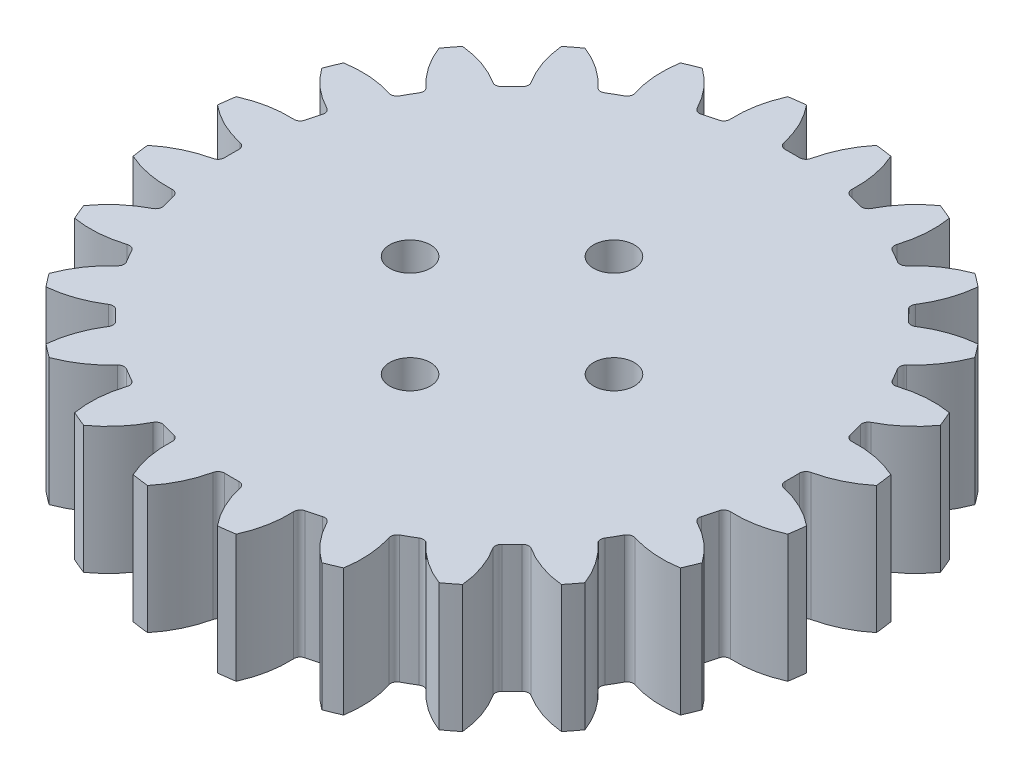
from build123d import *

# Parameters (mm, degrees)
SKETCH_1_R               = 26
EXTRUDE_1_DEPTH          = 10
CUT_EXTRUDE_1_DEPTH      = 39.105117767
PATTERN_CIRCULAR_1_COUNT = 24
SKETCH_3_R               = 1.6
CUT_EXTRUDE_2_DEPTH      = 38.907320131


with BuildPart() as part:
    # 草图1 → 凸台-拉伸1 (new body)
    with BuildSketch(Plane(origin=(0, 0, 0), x_dir=(1, 0, 0), z_dir=(0, 1, 0))):
        with Locations(Location((0, 0, 0), (0, 0, 270))):
            Circle(SKETCH_1_R)
    extrude(amount=EXTRUDE_1_DEPTH)

    # 草图2 → 切除-拉伸1 (cut, through all)
    with BuildSketch(Plane(origin=(0, 0, 0), x_dir=(1, 0, 0), z_dir=(0, 1, 0))):
        with BuildLine():
            ThreePointArc((0.560547841, 21.992857616), (0, 22), (-0.560547841, 21.992857616))
            ThreePointArc((-0.560547841, 21.992857616), (-0.882061796, 22.099428872), (-1.06187474, 22.386475838))
            ThreePointArc((-1.06187474, 22.386475838), (-1.695394394, 24.220742425), (-2.741813312, 25.855027746))
            ThreePointArc((-2.741813312, 25.855027746), (0, 26), (2.741813312, 25.855027746))
            ThreePointArc((2.741813312, 25.855027746), (1.695394394, 24.220742425), (1.06187474, 22.386475838))
            ThreePointArc((1.06187474, 22.386475838), (0.882061796, 22.099428872), (0.560547841, 21.992857616))
        make_face()
    cut_extrude_1 = extrude(amount=CUT_EXTRUDE_1_DEPTH, mode=Mode.SUBTRACT)

    # 阵列(圆周)1: 切除-拉伸1 ×24 about axis
    pattern_circular_1_axis = Axis((0, 0, 0), (0, 1, 0))
    for i in range(1, PATTERN_CIRCULAR_1_COUNT):
        add(cut_extrude_1.rotate(pattern_circular_1_axis, i * 360 / PATTERN_CIRCULAR_1_COUNT), mode=Mode.SUBTRACT)

    # 草图3 → 切除-拉伸2 (cut, through all)
    with BuildSketch(Plane(origin=(0, 0, 0), x_dir=(1, 0, 0), z_dir=(0, 1, 0))):
        with Locations(Location((0, 8, 0), (0, 0, 270))):
            Circle(SKETCH_3_R)
        with Locations(Location((8, 0, 0), (0, 0, 270))):
            Circle(SKETCH_3_R)
        with Locations(Location((0, -8, 0), (0, 0, 270))):
            Circle(SKETCH_3_R)
        with Locations(Location((-8, 0, 0), (0, 0, 270))):
            Circle(SKETCH_3_R)
    extrude(amount=CUT_EXTRUDE_2_DEPTH, mode=Mode.SUBTRACT)


solid = part.part
